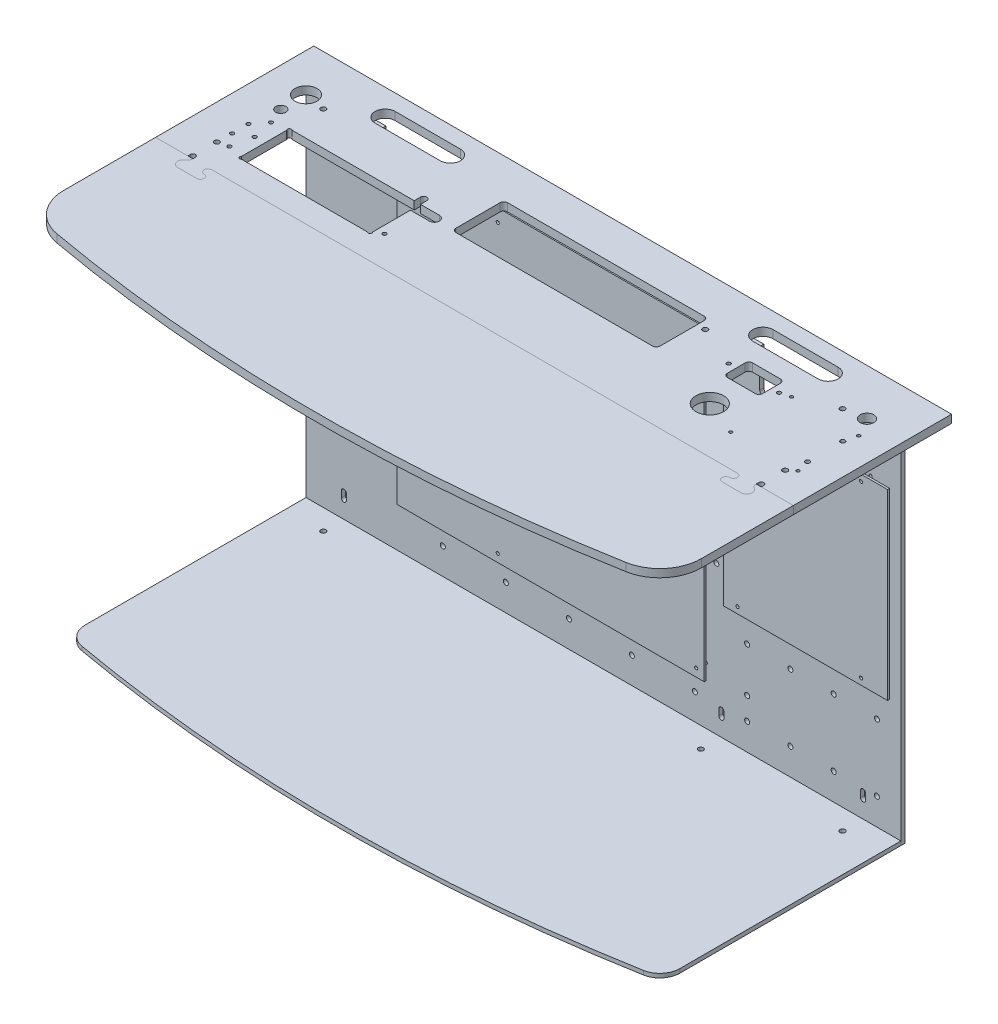
from build123d import *

# Parameters (mm, degrees)
BOSS_EXTRUDE1_DEPTH = 6.35
SKETCH2_W           = 472
SKETCH2_H           = 287
BOSS_EXTRUDE2_DEPTH = 3.2
CUT_EXTRUDE1_DEPTH  = 446.276139042
SKETCH4_W           = 243.84
SKETCH4_H           = 243.84
SKETCH4_R           = 1.25
BOSS_EXTRUDE3_DEPTH = 1.6
SKETCH12_W          = 130
SKETCH12_H          = 145
SKETCH12_R          = 1.25
BOSS_EXTRUDE4_DEPTH = 1.6
SKETCH6_R           = 1.25
CUT_EXTRUDE3_DEPTH  = 446.276139042
CUT_EXTRUDE2_DEPTH  = 403.651524274
SKETCH7_R           = 2
CUT_EXTRUDE4_DEPTH  = 403.651524274
SKETCH8_R           = 2
CUT_EXTRUDE5_DEPTH  = 446.276139042
SKETCH9_R           = 5.45
SKETCH9_R_2         = 8.73125
SKETCH9_R_3         = 4
CUT_EXTRUDE6_DEPTH  = 403.651524274
SKETCH10_R          = 1.5
SKETCH10_W          = 28
SKETCH10_H          = 20
CUT_EXTRUDE7_DEPTH  = 403.651524274
FILLET1_R           = 3
SKETCH11_R          = 11
CUT_EXTRUDE8_DEPTH  = 403.651524274
SKETCH13_R          = 1.5
CUT_EXTRUDE9_DEPTH  = 403.651524274
SKETCH14_R          = 1.5
CUT_EXTRUDE10_DEPTH = 403.651524274
CUT_EXTRUDE15_DEPTH = 403.651524274
SKETCH15_R          = 2
CUT_EXTRUDE11_DEPTH = 446.276139042
SKETCH16_R          = 2
CUT_EXTRUDE12_DEPTH = 403.651524274
SKETCH17_R          = 2
BOSS_EXTRUDE5_DEPTH = 3.2
SKETCH18_R          = 1.25
SKETCH18_R_2        = 1.75
CUT_EXTRUDE13_DEPTH = 403.651524274
BOSS_EXTRUDE6_DEPTH = 6.35
CUT_EXTRUDE14_DEPTH = 403.651524274


with BuildPart() as part:
    # Sketch1 → Boss-Extrude1 (new body)
    with BuildSketch(Plane(origin=(0, 0, 0), x_dir=(1, 0, 0), z_dir=(0, 1, 0))):
        with BuildLine():
            Line((-253, 125.5), (253, 125.5))
            Line((253, 125.5), (253, -73.008828273))
            ThreePointArc((253, -73.008828273), (245.302764436, -94.193023133), (225.801811401, -105.494809626))
            ThreePointArc((225.801811401, -105.494809626), (0, -125.5), (-225.801811401, -105.494809626))
            ThreePointArc((-225.801811401, -105.494809626), (-245.302764436, -94.193023133), (-253, -73.008828273))
            Line((-253, -73.008828273), (-253, 125.5))
        make_face()
        with BuildLine():
            Line((175.75, 96.8), (124, 96.8))
            ThreePointArc((124, 96.8), (116, 104.8), (124, 112.8))
            Line((124, 112.8), (175.75, 112.8))
            ThreePointArc((175.75, 112.8), (183.75, 104.8), (175.75, 96.8))
        make_face(mode=Mode.SUBTRACT)
        with BuildLine():
            Line((-175.75, 112.8), (-124, 112.8))
            ThreePointArc((-124, 112.8), (-116, 104.8), (-124, 96.8))
            Line((-124, 96.8), (-175.75, 96.8))
            ThreePointArc((-175.75, 96.8), (-183.75, 104.8), (-175.75, 112.8))
        make_face(mode=Mode.SUBTRACT)
    extrude(amount=BOSS_EXTRUDE1_DEPTH)

    # Sketch5 → Cut-Extrude2 (cut, through all)
    with BuildSketch(Plane.XZ):
        with BuildLine():
            Line((90.55, -56.7), (90.55, -91.7))
            ThreePointArc((90.55, -91.7), (89.671320344, -93.821320344), (87.55, -94.7))
            Line((87.55, -94.7), (-68.45, -94.7))
            ThreePointArc((-68.45, -94.7), (-70.571320344, -93.821320344), (-71.45, -91.7))
            Line((-71.45, -91.7), (-71.45, -56.7))
            ThreePointArc((-71.45, -56.7), (-70.571320344, -54.578679656), (-68.45, -53.7))
            Line((-68.45, -53.7), (87.55, -53.7))
            ThreePointArc((87.55, -53.7), (89.671320344, -54.578679656), (90.55, -56.7))
        make_face()
    extrude(amount=-CUT_EXTRUDE2_DEPTH, mode=Mode.SUBTRACT)

    # Sketch7 → Cut-Extrude4 (cut, through all)
    with BuildSketch(Plane.XZ):
        with Locations(Location((97.05, -86, 0), (0, 0, 270))):
            Circle(SKETCH7_R)
        with Locations(Location((-206, -86, 0), (0, 0, 270))):
            Circle(SKETCH7_R)
        with Locations(Location((206, -86, 0), (0, 0, 270))):
            Circle(SKETCH7_R)
    extrude(amount=-CUT_EXTRUDE4_DEPTH, mode=Mode.SUBTRACT)

    # Sketch9 → Cut-Extrude6 (cut, through all)
    with BuildSketch(Plane.XZ):
        with Locations(Location((222.55, -88.85, 0), (0, 0, 270))):
            Circle(SKETCH9_R)
        with Locations(Location((-222.55, -88.85, 0), (0, 0, 270))):
            Circle(SKETCH9_R_2)
        with Locations(Location((-222.55, -68.85, 0), (0, 0, 270))):
            Circle(SKETCH9_R_3)
    extrude(amount=-CUT_EXTRUDE6_DEPTH, mode=Mode.SUBTRACT)

    # Sketch10 → Cut-Extrude7 (cut, through all)
    with BuildSketch(Plane.XZ):
        with Locations(Location((129.875, -71.8, 0), (0, 0, 270))):
            Circle(SKETCH10_R)
        with Locations(Location((169.875, -71.8, 0), (0, 0, 270))):
            Circle(SKETCH10_R)
        with Locations((149.875, -71.8)):
            Rectangle(SKETCH10_W, SKETCH10_H)
    extrude(amount=-CUT_EXTRUDE7_DEPTH, mode=Mode.SUBTRACT)

    # Fillet1
    fillet1_edges = [part.edges().sort_by_distance(p)[0] for p in [
        (163.875, 3.175, -61.8),
        (163.875, 3.175, -81.8),
        (135.875, 3.175, -81.8),
        (135.875, 3.175, -61.8),
    ]]
    fillet(fillet1_edges, radius=FILLET1_R)

    # Sketch11 → Cut-Extrude8 (cut, through all)
    with BuildSketch(Plane.XZ):
        with Locations(Location((149.875, -36.8, 0), (0, 0, 270))):
            Circle(SKETCH11_R)
    extrude(amount=-CUT_EXTRUDE8_DEPTH, mode=Mode.SUBTRACT)

    # Sketch13 → Cut-Extrude9 (cut, through all)
    with BuildSketch(Plane.XZ):
        with Locations(Location((-213.987106781, -39.5, 0), (0, 0, 270))):
            Circle(SKETCH13_R)
        with Locations(Location((-217.487106781, -56, 0), (0, 0, 270))):
            Circle(SKETCH13_R)
        with Locations(Location((-225.37, -46, 0), (0, 0, 270))):
            Circle(SKETCH13_R)
        with Locations(Location((-225.37, -33, 0), (0, 0, 90))):
            Circle(SKETCH13_R)
        with Locations(Location((-217.487106781, -23, 0), (0, 0, 90))):
            Circle(SKETCH13_R)
        with Locations(Location((-95.87, -24.5, 0), (0, 0, 270))):
            Circle(SKETCH13_R)
        Polygon((-205.87, -59), (-102.87, -59), (-101.87, -59), (-101.87, -19), (-205.87, -19), (-205.87, -20), align=None)
    extrude(amount=-CUT_EXTRUDE9_DEPTH, mode=Mode.SUBTRACT)

    # Sketch14 → Cut-Extrude10 (cut, through all)
    with BuildSketch(Plane.XZ):
        with Locations((-204.809339828, -20.060660172)):
            Circle(SKETCH14_R)
        with Locations((-204.809339828, -57.939339828)):
            Circle(SKETCH14_R)
        with Locations((-102.930660172, -20.060660172)):
            Circle(SKETCH14_R)
        with BuildLine():
            Line((-101.87, -59), (-101.87, -64))
            ThreePointArc((-101.87, -64), (-104.37, -66.5), (-106.87, -64))
            Line((-106.87, -64), (-106.87, -59))
            Line((-106.87, -59), (-101.87, -59))
        make_face()
    extrude(amount=-CUT_EXTRUDE10_DEPTH, mode=Mode.SUBTRACT)

    # Sketch20 → Cut-Extrude15 (cut, through all)
    with BuildSketch(Plane.XZ):
        with BuildLine():
            Line((-101.87, -51), (-86.87, -51))
            ThreePointArc((-86.87, -51), (-82.87, -55), (-86.87, -59))
            Line((-86.87, -59), (-101.87, -59))
            Line((-101.87, -59), (-101.87, -51))
        make_face()
    extrude(amount=-CUT_EXTRUDE15_DEPTH, mode=Mode.SUBTRACT)

    # Sketch16 → Cut-Extrude12 (cut, through all)
    with BuildSketch(Plane.XZ):
        with Locations(Location((-225.487106781, -21, 0), (0, 0, 270))):
            Circle(SKETCH16_R)
        with Locations(Location((225.487106781, -21, 0), (0, 0, 90))):
            Circle(SKETCH16_R)
        with BuildLine():
            Line((-227.487106781, -2), (-227.487106781, 0))
            Line((-227.487106781, 0), (-223.487106781, 0))
            Line((-223.487106781, 0), (-223.487106781, -2))
            ThreePointArc((-223.487106781, -2), (-225.487106781, -4), (-227.487106781, -2))
        make_face()
        with BuildLine():
            Line((223.487106781, -2), (223.487106781, 0))
            Line((223.487106781, 0), (227.487106781, 0))
            Line((227.487106781, 0), (227.487106781, -2))
            ThreePointArc((227.487106781, -2), (225.487106781, -4), (223.487106781, -2))
        make_face()
    extrude(amount=-CUT_EXTRUDE12_DEPTH, mode=Mode.SUBTRACT)


with BuildPart() as body_2:
    # Sketch2 → Boss-Extrude2 (new body)
    with BuildSketch(Plane(origin=(0, 0, -105.5), x_dir=(-1, 0, 0), z_dir=(0, 0, -1))):
        with Locations((0, -143.5)):
            Rectangle(SKETCH2_W, SKETCH2_H)
    extrude(amount=-BOSS_EXTRUDE2_DEPTH)

    # Sketch3 → Cut-Extrude1 (cut, through all)
    with BuildSketch(Plane.XY.offset(-102.3)):
        with BuildLine():
            Line((-172.75, -33), (-127, -33))
            ThreePointArc((-127, -33), (-124.878679656, -32.121320344), (-124, -30))
            Line((-124, -30), (-124, 0))
            Line((-124, 0), (-175.75, 0))
            Line((-175.75, 0), (-175.75, -30))
            ThreePointArc((-175.75, -30), (-174.871320344, -32.121320344), (-172.75, -33))
        make_face()
        with BuildLine():
            Line((124, -30), (124, 0))
            Line((124, 0), (175.75, 0))
            Line((175.75, 0), (175.75, -30))
            ThreePointArc((175.75, -30), (174.871320344, -32.121320344), (172.75, -33))
            Line((172.75, -33), (127, -33))
            ThreePointArc((127, -33), (124.878679656, -32.121320344), (124, -30))
        make_face()
    extrude(amount=-CUT_EXTRUDE1_DEPTH, mode=Mode.SUBTRACT)

    # Sketch6 → Cut-Extrude3 (cut, through all)
    with BuildSketch(Plane.XY.offset(-102.3)):
        with Locations((-76.28, -238.49)):
            Circle(SKETCH6_R)
        with Locations((-76.28, -166.1)):
            Circle(SKETCH6_R)
        with Locations((-122, -166.1)):
            Circle(SKETCH6_R)
        with Locations((-142.32, -166.1)):
            Circle(SKETCH6_R)
        with Locations((81.2, -166.1)):
            Circle(SKETCH6_R)
        with Locations((81.2, -238.49)):
            Circle(SKETCH6_R)
        with Locations((81.2, -34.02)):
            Circle(SKETCH6_R)
        with Locations((-122, -11.16)):
            Circle(SKETCH6_R)
        with Locations((-76.28, -11.16)):
            Circle(SKETCH6_R)
        with Locations((114, -180)):
            Circle(SKETCH6_R)
        with Locations((212, -180)):
            Circle(SKETCH6_R)
        with Locations((212, -45)):
            Circle(SKETCH6_R)
        with Locations((114, -45)):
            Circle(SKETCH6_R)
    extrude(amount=-CUT_EXTRUDE3_DEPTH, mode=Mode.SUBTRACT)

    # Sketch8 → Cut-Extrude5 (cut, through all)
    with BuildSketch(Plane.XY.offset(-102.3)):
        with Locations((-206, -16.3)):
            Circle(SKETCH8_R)
        with Locations((97.05, -16.3)):
            Circle(SKETCH8_R)
        with Locations((206, -16.3)):
            Circle(SKETCH8_R)
        with BuildLine():
            Line((-204, -265), (-204, -270))
            ThreePointArc((-204, -270), (-206, -272), (-208, -270))
            Line((-208, -270), (-208, -265))
            ThreePointArc((-208, -265), (-206, -263), (-204, -265))
        make_face()
        with BuildLine():
            Line((91.55, -270), (91.55, -265))
            ThreePointArc((91.55, -265), (93.55, -263), (95.55, -265))
            Line((95.55, -265), (95.55, -270))
            ThreePointArc((95.55, -270), (93.55, -272), (91.55, -270))
        make_face()
        with BuildLine():
            Line((204, -265), (204, -270))
            ThreePointArc((204, -270), (206, -272), (208, -270))
            Line((208, -270), (208, -265))
            ThreePointArc((208, -265), (206, -263), (204, -265))
        make_face()
    extrude(amount=-CUT_EXTRUDE5_DEPTH, mode=Mode.SUBTRACT)

    # Sketch15 → Cut-Extrude11 (cut, through all)
    with BuildSketch(Plane.XY.offset(-102.3)):
        with Locations((114, -209.5)):
            Circle(SKETCH15_R)
        with Locations((114, -262.5)):
            Circle(SKETCH15_R)
        with Locations((148.333333333, -262.5)):
            Circle(SKETCH15_R)
        with Locations((148.333333333, -209.5)):
            Circle(SKETCH15_R)
        with Locations((182.666666667, -262.5)):
            Circle(SKETCH15_R)
        with Locations((182.666666667, -209.5)):
            Circle(SKETCH15_R)
        with Locations((217, -262.5)):
            Circle(SKETCH15_R)
        with Locations((217, -209.5)):
            Circle(SKETCH15_R)
        with Locations((114, -189)):
            Circle(SKETCH15_R)
        with Locations((148.333333333, -189)):
            Circle(SKETCH15_R)
        with Locations((182.666666667, -189)):
            Circle(SKETCH15_R)
        with Locations((217, -189)):
            Circle(SKETCH15_R)
        with Locations((114, -244.84)):
            Circle(SKETCH15_R)
        with Locations((89.55, -84.02)):
            Circle(SKETCH15_R)
        with Locations((101, -84.02)):
            Circle(SKETCH15_R)
        with Locations((89.55, -166.1)):
            Circle(SKETCH15_R)
        with Locations((101, -166.1)):
            Circle(SKETCH15_R)
        with Locations((72.55, -247.84)):
            Circle(SKETCH15_R)
        with Locations((72.55, -262.84)):
            Circle(SKETCH15_R)
        with Locations((22.55, -247.84)):
            Circle(SKETCH15_R)
        with Locations((22.55, -262.84)):
            Circle(SKETCH15_R)
        with Locations((-27.45, -247.84)):
            Circle(SKETCH15_R)
        with Locations((-27.45, -262.84)):
            Circle(SKETCH15_R)
        with Locations((-77.45, -247.84)):
            Circle(SKETCH15_R)
        with Locations((-77.45, -262.84)):
            Circle(SKETCH15_R)
        with Locations((-127.45, -247.84)):
            Circle(SKETCH15_R)
        with Locations((-127.45, -262.84)):
            Circle(SKETCH15_R)
    extrude(amount=-CUT_EXTRUDE11_DEPTH, mode=Mode.SUBTRACT)


with BuildPart() as body_3:
    # Sketch4 → Boss-Extrude3 (new body)
    with BuildSketch(Plane.XY.offset(-96.3)):
        with Locations((-34.37, -122.92)):
            Rectangle(SKETCH4_W, SKETCH4_H)
        with Locations((-122, -11.16)):
            Circle(SKETCH4_R, mode=Mode.SUBTRACT)
        with Locations((-76.28, -11.16)):
            Circle(SKETCH4_R, mode=Mode.SUBTRACT)
        with Locations((-122, -166.1)):
            Circle(SKETCH4_R, mode=Mode.SUBTRACT)
        with Locations((-76.28, -166.1)):
            Circle(SKETCH4_R, mode=Mode.SUBTRACT)
        with Locations((-142.32, -166.1)):
            Circle(SKETCH4_R, mode=Mode.SUBTRACT)
        with Locations((81.2, -34.02)):
            Circle(SKETCH4_R, mode=Mode.SUBTRACT)
        with Locations((-76.28, -238.49)):
            Circle(SKETCH4_R, mode=Mode.SUBTRACT)
        with Locations((81.2, -166.1)):
            Circle(SKETCH4_R, mode=Mode.SUBTRACT)
        with Locations((81.2, -238.49)):
            Circle(SKETCH4_R, mode=Mode.SUBTRACT)
    extrude(amount=BOSS_EXTRUDE3_DEPTH)


with BuildPart() as body_4:
    # Sketch12 → Boss-Extrude4 (new body)
    with BuildSketch(Plane.XY.offset(-96.3)):
        with Locations((168, -112.5)):
            Rectangle(SKETCH12_W, SKETCH12_H)
        with Locations((212, -45)):
            Circle(SKETCH12_R, mode=Mode.SUBTRACT)
        with Locations((212, -180)):
            Circle(SKETCH12_R, mode=Mode.SUBTRACT)
        with Locations((114, -180)):
            Circle(SKETCH12_R, mode=Mode.SUBTRACT)
        with Locations((114, -45)):
            Circle(SKETCH12_R, mode=Mode.SUBTRACT)
    extrude(amount=BOSS_EXTRUDE4_DEPTH)


with BuildPart() as body_5:
    # Split1: the piece on the far side of the plane
    add(part.part)
    split(bisect_by=Plane.XY, keep=Keep.BOTTOM)

    # Sketch18 → Cut-Extrude13 (cut, through all)
    with BuildSketch(Plane.XZ):
        with Locations(Location((177.66, -25.59, 0), (0, 0, 270))):
            Circle(SKETCH18_R)
        with Locations(Location((231, -25.59, 0), (0, 0, 270))):
            Circle(SKETCH18_R)
        with Locations(Location((231, -73.85, 0), (0, 0, 270))):
            Circle(SKETCH18_R)
        with Locations(Location((177.66, -73.85, 0), (0, 0, 270))):
            Circle(SKETCH18_R)
        with Locations(Location((228.46, -35.75, 0), (0, 0, 270))):
            Circle(SKETCH18_R_2)
        with Locations(Location((228.46, -63.69, 0), (0, 0, 270))):
            Circle(SKETCH18_R_2)
    extrude(amount=-CUT_EXTRUDE13_DEPTH, mode=Mode.SUBTRACT)

    # Sketch19 → Boss-Extrude6 (add)
    with BuildSketch(Plane.XZ):
        with BuildLine():
            Line((-223.487106781, 12), (-208.487106781, 12))
            ThreePointArc((-208.487106781, 12), (-205.487106781, 9), (-208.487106781, 6))
            ThreePointArc((-208.487106781, 6), (-211.487106781, 3), (-208.487106781, 0))
            Line((-208.487106781, 0), (-223.487106781, 0))
            ThreePointArc((-223.487106781, 0), (-224.075564049, 2.196152423), (-225.683259204, 3.803847577))
            ThreePointArc((-225.683259204, 3.803847577), (-227.729747468, 8.7445073), (-223.487106781, 12))
        make_face()
        with BuildLine():
            Line((223.487106781, 12), (208.487106781, 12))
            ThreePointArc((208.487106781, 12), (205.487106781, 9), (208.487106781, 6))
            ThreePointArc((208.487106781, 6), (211.487106781, 3), (208.487106781, 0))
            Line((208.487106781, 0), (223.487106781, 0))
            ThreePointArc((223.487106781, 0), (224.075564049, 2.196152423), (225.683259204, 3.803847577))
            ThreePointArc((225.683259204, 3.803847577), (227.729747468, 8.7445073), (223.487106781, 12))
        make_face()
    extrude(amount=-BOSS_EXTRUDE6_DEPTH)


with BuildPart() as part_1:
    add(part.part)

    # Split1
    split(bisect_by=Plane.XY, keep=Keep.TOP)

    # Sketch19<2> → Cut-Extrude14 (cut, through all)
    with BuildSketch(Plane.XZ):
        with BuildLine():
            Line((-223.487106781, 12), (-208.487106781, 12))
            ThreePointArc((-208.487106781, 12), (-205.487106781, 9), (-208.487106781, 6))
            ThreePointArc((-208.487106781, 6), (-211.487106781, 3), (-208.487106781, 0))
            Line((-208.487106781, 0), (-223.487106781, 0))
            ThreePointArc((-223.487106781, 0), (-224.075564049, 2.196152423), (-225.683259204, 3.803847577))
            ThreePointArc((-225.683259204, 3.803847577), (-227.729747468, 8.7445073), (-223.487106781, 12))
        make_face()
        with BuildLine():
            Line((223.487106781, 12), (208.487106781, 12))
            ThreePointArc((208.487106781, 12), (205.487106781, 9), (208.487106781, 6))
            ThreePointArc((208.487106781, 6), (211.487106781, 3), (208.487106781, 0))
            Line((208.487106781, 0), (223.487106781, 0))
            ThreePointArc((223.487106781, 0), (224.075564049, 2.196152423), (225.683259204, 3.803847577))
            ThreePointArc((225.683259204, 3.803847577), (227.729747468, 8.7445073), (223.487106781, 12))
        make_face()
    extrude(amount=-CUT_EXTRUDE14_DEPTH, mode=Mode.SUBTRACT)


with BuildPart() as body_6:
    # Sketch17 → Boss-Extrude5 (new body)
    with BuildSketch(Plane.XZ.offset(287)):
        with BuildLine():
            Line((236, 73.008828273), (236, -102.3))
            Line((236, -102.3), (-236, -102.3))
            Line((-236, -102.3), (-236, 73.008828273))
            ThreePointArc((-236, 73.008828273), (-232.268006999, 83.279953054), (-222.812999467, 88.759607111))
            ThreePointArc((-222.812999467, 88.759607111), (0, 108.5), (222.812999467, 88.759607111))
            ThreePointArc((222.812999467, 88.759607111), (232.268006999, 83.279953054), (236, 73.008828273))
        make_face()
        with Locations((-206, -86)):
            Circle(SKETCH17_R, mode=Mode.SUBTRACT)
        with Locations((93.55, -86)):
            Circle(SKETCH17_R, mode=Mode.SUBTRACT)
        with Locations((206, -86)):
            Circle(SKETCH17_R, mode=Mode.SUBTRACT)
    extrude(amount=-BOSS_EXTRUDE5_DEPTH)


solid = Compound([body_2.part, body_3.part, body_4.part, body_5.part, part_1.part, body_6.part])
